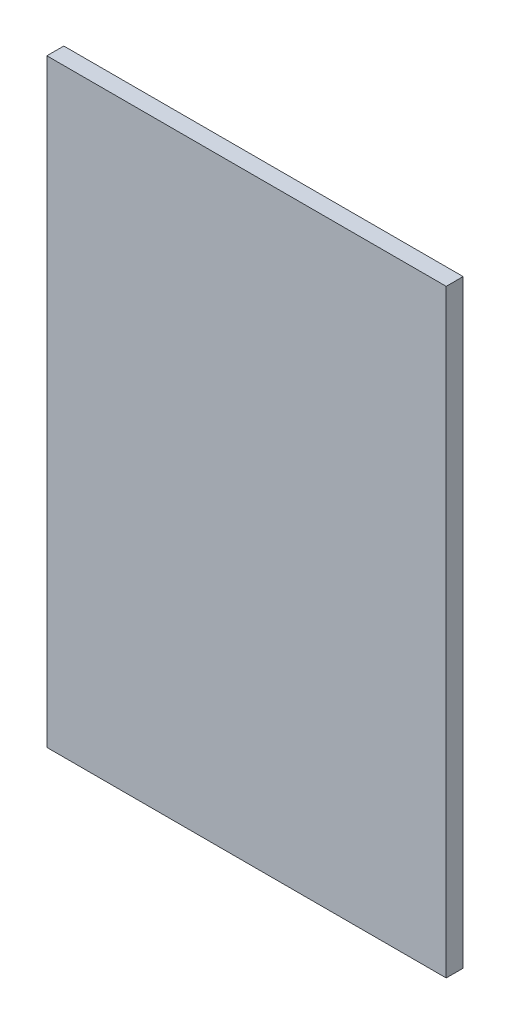
from build123d import *

# Parameters (mm, degrees)
SKETCH1_W           = 599.44
SKETCH1_H           = 25.4
BOSS_EXTRUDE1_DEPTH = 449.58


with BuildPart() as part:
    # Sketch1 → Boss-Extrude1 (new, symmetric)
    with BuildSketch(Plane(origin=(0, 0, 0), x_dir=(1, 0, 0), z_dir=(0, 1, 0))):
        with Locations((-74.93, 0)):
            Rectangle(SKETCH1_W, SKETCH1_H)
    extrude(amount=BOSS_EXTRUDE1_DEPTH, both=True)


solid = part.part
